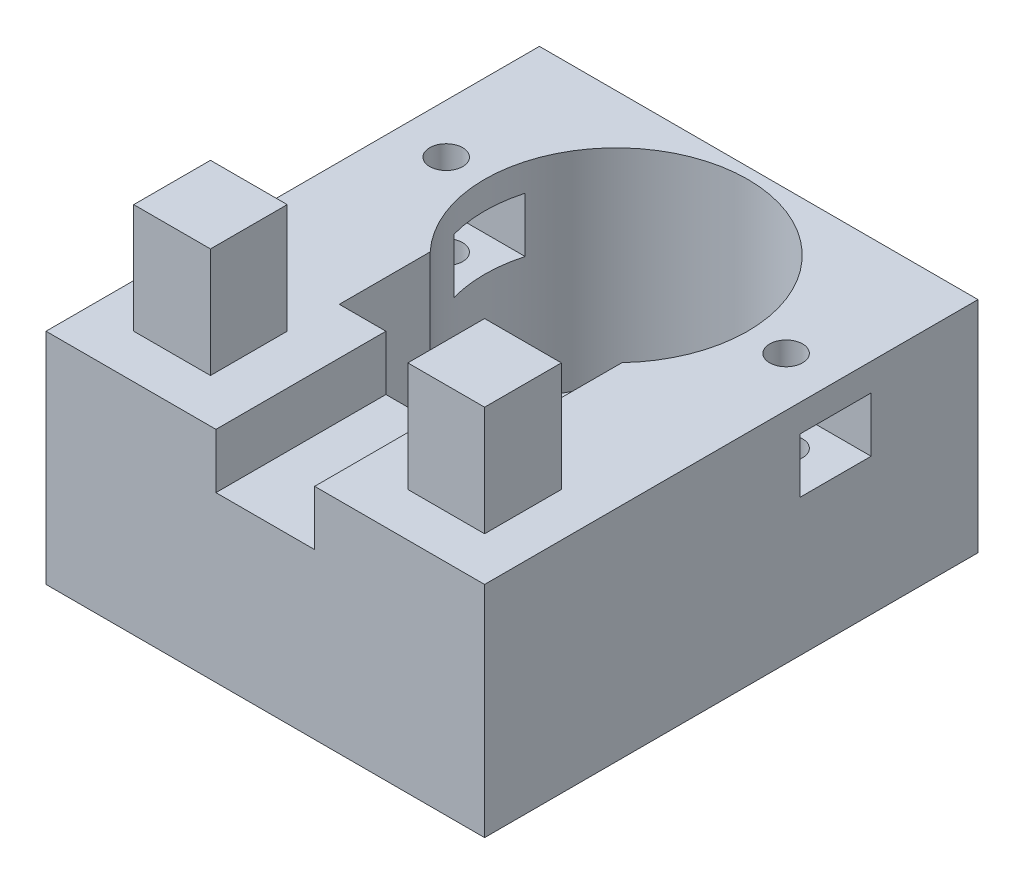
from build123d import *

# Parameters (mm, degrees)
ESBO_O2_W                = 40
ESBO_O2_H                = 45
CORPO_DEPTH              = 20
ESBO_O3_R                = 12
ESBO_O3_W                = 17.5
ESBO_O3_H                = 9
ENCAIXE_DO_MOTOR_DEPTH   = 19
ESBO_O5_R                = 1.5
CORTE_EXTRUS_O2_DEPTH    = 64.442887702
ESBO_O6_W                = 6.5
ESBO_O6_H                = 5
CORTE_EXTRUS_O3_DEPTH    = 64.442887702
ESBO_O7_W                = 9
ESBO_O7_H                = 21.613382206
CORTE_EXTRUS_O4_DEPTH    = 5
ESBO_O8_W                = 7
ESBO_O8_H                = 7
RESSALTO_EXTRUS_O2_DEPTH = 10


with BuildPart() as part:
    # Esboço2 → Corpo (new body)
    with BuildSketch(Plane(origin=(0, 0, 0), x_dir=(1, 0, 0), z_dir=(0, 1, 0))):
        with Locations((20, 22.5)):
            Rectangle(ESBO_O2_W, ESBO_O2_H)
    extrude(amount=CORPO_DEPTH)

    # Esboço3 → Encaixe do Motor (cut)
    with BuildSketch(Plane(origin=(0, 20, 0), x_dir=(1, 0, 0), z_dir=(0, 1, 0))):
        with Locations((20, 32)):
            Circle(ESBO_O3_R)
        with Locations((20, 20)):
            Rectangle(ESBO_O3_W, ESBO_O3_H)
    extrude(amount=-ENCAIXE_DO_MOTOR_DEPTH, mode=Mode.SUBTRACT)

    # Esboço5 → Corte-extrusão2 (cut, through all)
    with BuildSketch(Plane(origin=(0, 20, 0), x_dir=(1, 0, 0), z_dir=(0, 1, 0))):
        with Locations(Location((4.5, 32, 0), (0, 0, 270))):
            Circle(ESBO_O5_R)
        with Locations(Location((35.5, 32, 0), (0, 0, 270))):
            Circle(ESBO_O5_R)
    extrude(amount=-CORTE_EXTRUS_O2_DEPTH, mode=Mode.SUBTRACT)

    # Esboço6 → Corte-extrusão3 (cut, through all)
    with BuildSketch(Plane(origin=(40, 0, 0), x_dir=(0, 0, -1), z_dir=(1, 0, 0))):
        with Locations((32, 15)):
            Rectangle(ESBO_O6_W, ESBO_O6_H)
    extrude(amount=-CORTE_EXTRUS_O3_DEPTH, mode=Mode.SUBTRACT)

    # Esboço7 → Corte-extrusão4 (cut)
    with BuildSketch(Plane(origin=(0, 20, 0), x_dir=(1, 0, 0), z_dir=(0, 1, 0))):
        with Locations((20, 7.545181244)):
            Rectangle(ESBO_O7_W, ESBO_O7_H)
    extrude(amount=-CORTE_EXTRUS_O4_DEPTH, mode=Mode.SUBTRACT)

    # Esboço8 → Ressalto-extrusão2 (add)
    with BuildSketch(Plane(origin=(0, 20, 0), x_dir=(1, 0, 0), z_dir=(0, 1, 0))):
        with Locations((32.5, 7.5)):
            Rectangle(ESBO_O8_W, ESBO_O8_H)
        with Locations((7.5, 7.5)):
            Rectangle(ESBO_O8_W, ESBO_O8_H)
    extrude(amount=RESSALTO_EXTRUS_O2_DEPTH)


solid = part.part
